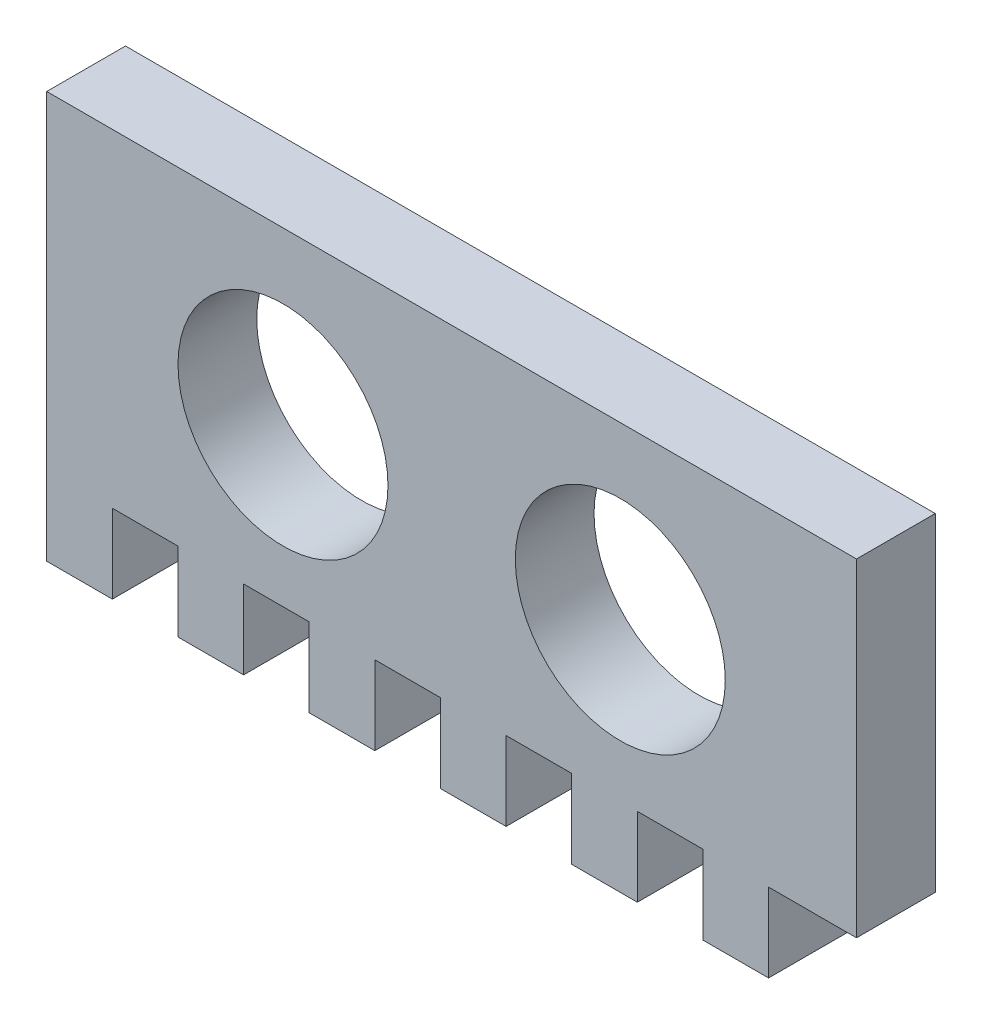
from build123d import *

# Parameters (mm, degrees)
ESQUISSE1_R        = 8
BOSS_EXTRU_1_DEPTH = 6


with BuildPart() as part:
    # Esquisse1 → Boss.-Extru.1 (new body)
    with BuildSketch(Plane.XY):
        Polygon((0, 0), (0, 31), (61.7, 31), (61.7, 6), (55, 6), (55, 0), (50, 0), (50, 6), (45, 6), (45, 0), (40, 0), (40, 6), (35, 6), (35, 0), (30, 0), (30, 6), (25, 6), (25, 0), (20, 0), (20, 6), (15, 6), (15, 0), (10, 0), (10, 6), (5, 6), (5, 0), align=None)
        with Locations((18, 18)):
            Circle(ESQUISSE1_R, mode=Mode.SUBTRACT)
        with Locations((43.7, 18)):
            Circle(ESQUISSE1_R, mode=Mode.SUBTRACT)
    extrude(amount=BOSS_EXTRU_1_DEPTH)


solid = part.part
